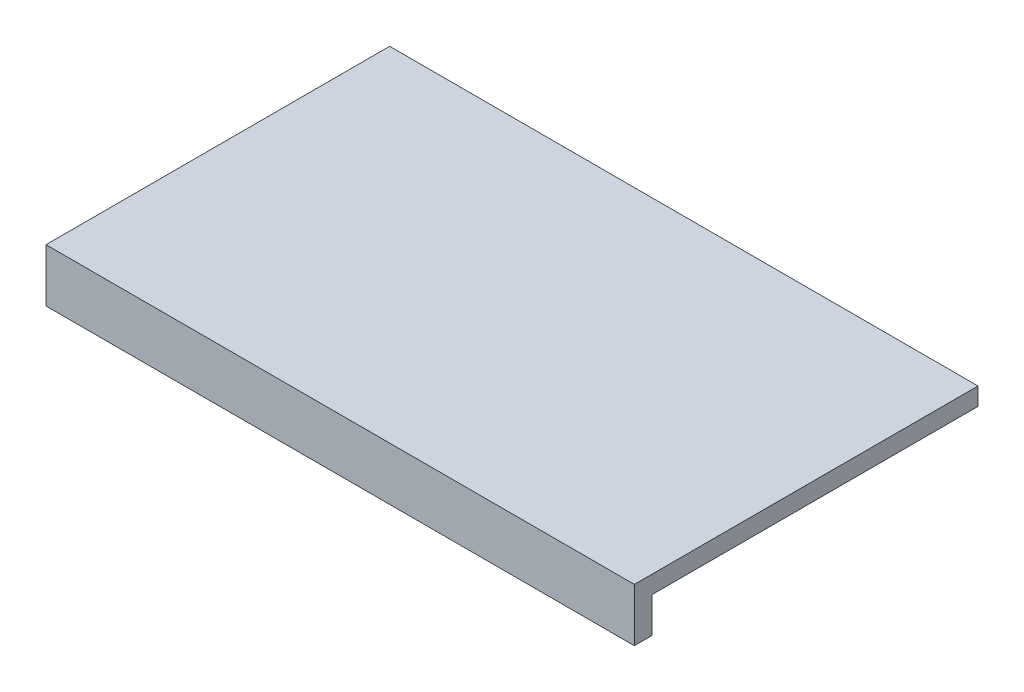
from build123d import *

# Parameters (mm, degrees)
SKETCH1_W           = 565
SKETCH1_H           = 330
BOSS_EXTRUDE1_DEPTH = 17
SKETCH2_W           = 565
SKETCH2_H           = 17
BOSS_EXTRUDE2_DEPTH = 34


with BuildPart() as part:
    # Sketch1 → Boss-Extrude1 (new body)
    with BuildSketch(Plane(origin=(0, 0, 0), x_dir=(1, 0, 0), z_dir=(0, 1, 0))):
        Rectangle(SKETCH1_W, SKETCH1_H)
    extrude(amount=BOSS_EXTRUDE1_DEPTH)

    # Sketch2 → Boss-Extrude2 (add)
    with BuildSketch(Plane.XZ):
        with Locations((0, 156.5)):
            Rectangle(SKETCH2_W, SKETCH2_H)
    extrude(amount=BOSS_EXTRUDE2_DEPTH)


solid = part.part
